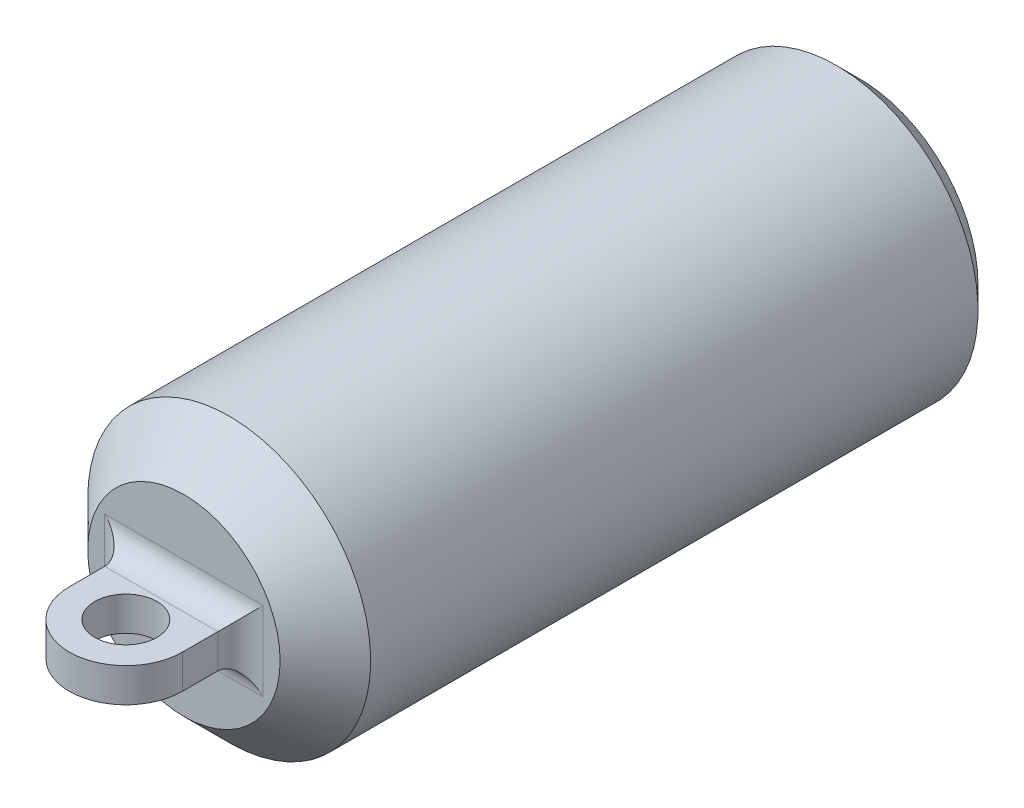
from build123d import *

# Parameters (mm, degrees)
SKETCH4_R           = 2.75
BOSS_EXTRUDE1_DEPTH = 1.5
BOSS_EXTRUDE2_START = 45
SKETCH5_R           = 12.5
BOSS_EXTRUDE2_DEPTH = 45
CHAMFER1_SIZE       = 4
FILLET1_R           = 2
CHAMFER2_SIZE       = 2


with BuildPart() as part:
    # Sketch3 → Revolve2 (revolve)
    with BuildSketch(Plane(origin=(0, 0, 0), x_dir=(0, 0, -1), z_dir=(1, 0, 0)), mode=Mode.PRIVATE) as revolve2_sk:
        Polygon((-4.082352568, 12.5), (4.082352568, 12.5), (4.082352568, 0), (-10.590979782, 0), (-10.590979782, 12.5), align=None)
    revolve(revolve2_sk.sketch.rotate(Axis((0, 0, 16.393474527), (0, 0, -1)), 90), axis=Axis((0, 0, 16.393474527), (0, 0, -1)))

    # Sketch4 → Boss-Extrude1 (add, symmetric)
    with BuildSketch(Plane(origin=(0, 0, 0), x_dir=(1, 0, 0), z_dir=(0, 1, 0))):
        with BuildLine():
            Line((-5, -15.723809824), (-5, -10.590979782))
            Line((-5, -10.590979782), (5, -10.590979782))
            Line((5, -10.590979782), (5, -15.723809824))
            ThreePointArc((5, -15.723809824), (0, -20.723809824), (-5, -15.723809824))
        make_face()
        with Locations(Location((0, -15.723809824, 0), (0, 0, 270))):
            Circle(SKETCH4_R, mode=Mode.SUBTRACT)
    extrude(amount=BOSS_EXTRUDE1_DEPTH, both=True)

    # Sketch5 → Boss-Extrude2 (add)
    with BuildSketch(Plane(origin=(0, 0, -4.082352568), x_dir=(-1, 0, 0), z_dir=(0, 0, -1)).offset(BOSS_EXTRUDE2_START)):
        with Locations(Location((0, 0, 0), (0, 0, 180))):
            Circle(SKETCH5_R)
    extrude(amount=-BOSS_EXTRUDE2_DEPTH)

    # Chamfer1
    chamfer1_edges = [part.edges().sort_by_distance(p)[0] for p in [
        (-12.5, 0, 10.590979782),
    ]]
    chamfer(chamfer1_edges, length=CHAMFER1_SIZE)

    # Fillet1
    fillet1_edges = [part.edges().sort_by_distance(p)[0] for p in [
        (0, 1.5, 10.590979782),
        (0, -1.5, 10.590979782),
        (5, 0, 10.590979782),
        (-5, 0, 10.590979782),
    ]]
    fillet(fillet1_edges, radius=FILLET1_R)

    # Chamfer2
    chamfer2_edges = [part.edges().sort_by_distance(p)[0] for p in [
        (-12.5, 0, -49.082352568),
    ]]
    chamfer(chamfer2_edges, length=CHAMFER2_SIZE)


solid = part.part
